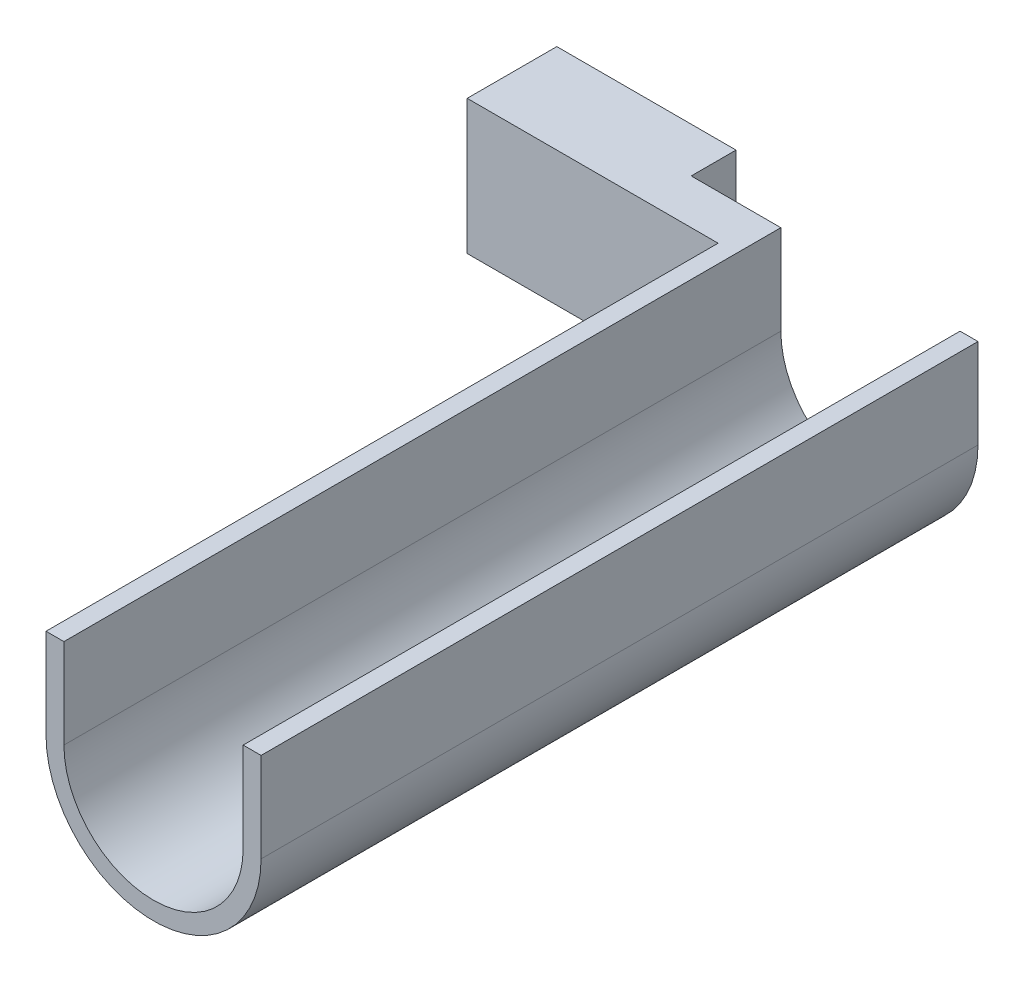
from build123d import *

# Parameters (mm, degrees)
BOSS_EXTRUDE1_DEPTH = 80
SKETCH2_W           = 30
SKETCH2_H           = 10
BOSS_EXTRUDE2_DEPTH = 5
SKETCH3_W           = 20
SKETCH3_H           = 10
BOSS_EXTRUDE3_DEPTH = 5
BOSS_EXTRUDE4_DEPTH = 5


with BuildPart() as part:
    # Sketch1 → Boss-Extrude1 (new body)
    with BuildSketch(Plane.XY):
        with BuildLine():
            Line((-10, 0), (-10, 10))
            Line((-10, 10), (-12, 10))
            Line((-12, 10), (-12, 0))
            ThreePointArc((-12, 0), (0, -12), (12, 0))
            Line((12, 0), (12, 10))
            Line((12, 10), (10, 10))
            Line((10, 10), (10, 0))
            ThreePointArc((10, 0), (0, -10), (-10, 0))
        make_face()
    extrude(amount=BOSS_EXTRUDE1_DEPTH)

    # Sketch2 → Boss-Extrude2 (add)
    with BuildSketch(Plane(origin=(0, 0, 0), x_dir=(-1, 0, 0), z_dir=(0, 0, -1))):
        with Locations((25, 5)):
            Rectangle(SKETCH2_W, SKETCH2_H)
    extrude(amount=-BOSS_EXTRUDE2_DEPTH)

    # Sketch3 → Boss-Extrude3 (add)
    with BuildSketch(Plane(origin=(0, 0, 0), x_dir=(-1, 0, 0), z_dir=(0, 0, -1))):
        with Locations((30, 5)):
            Rectangle(SKETCH3_W, SKETCH3_H)
    extrude(amount=BOSS_EXTRUDE3_DEPTH)

    # Sketch4 → Boss-Extrude4 (add)
    with BuildSketch(Plane.XZ):
        Polygon((-12, 0), (-12, 5), (-40, 5), (-40, -5), (-20, -5), (-20, 0), align=None)
    extrude(amount=BOSS_EXTRUDE4_DEPTH)


solid = part.part
